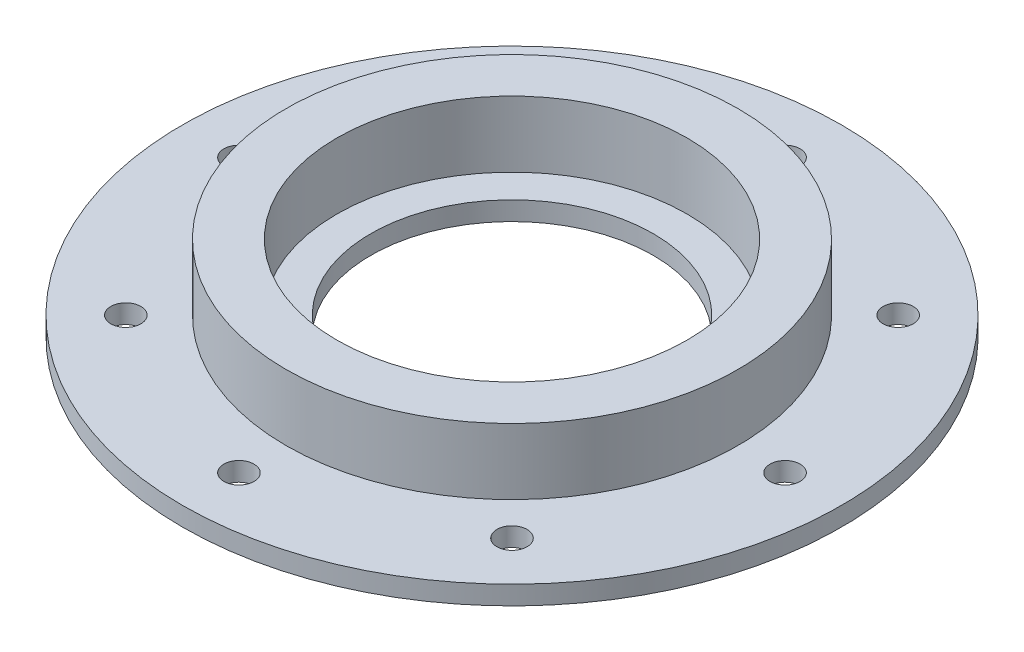
from build123d import *

# Parameters (mm, degrees)
SKETCH_1_R      = 35
SKETCH_1_R_2    = 15
SKETCH_1_R_3    = 1.6
EXTRUDE_1_DEPTH = 2
SKETCH_2_R      = 24
SKETCH_2_R_2    = 18.6
EXTRUDE_2_DEPTH = 7


with BuildPart() as part:
    # 草图1 → 凸台-拉伸1 (new body)
    with BuildSketch(Plane(origin=(0, 0, 0), x_dir=(1, 0, 0), z_dir=(0, 1, 0))):
        with Locations(Location((0, 0, 0), (0, 0, 270))):
            Circle(SKETCH_1_R)
        with Locations(Location((0, 0, 0), (0, 0, 270))):
            Circle(SKETCH_1_R_2, mode=Mode.SUBTRACT)
        with Locations(Location((29, 0, 0), (0, 0, 270))):
            Circle(SKETCH_1_R_3, mode=Mode.SUBTRACT)
        with Locations(Location((20.506096654, -20.506096654, 0), (0, 0, 270))):
            Circle(SKETCH_1_R_3, mode=Mode.SUBTRACT)
        with Locations(Location((0, -29, 0), (0, 0, 270))):
            Circle(SKETCH_1_R_3, mode=Mode.SUBTRACT)
        with Locations(Location((-20.506096654, -20.506096654, 0), (0, 0, 270))):
            Circle(SKETCH_1_R_3, mode=Mode.SUBTRACT)
        with Locations(Location((-29, 0, 0), (0, 0, 270))):
            Circle(SKETCH_1_R_3, mode=Mode.SUBTRACT)
        with Locations(Location((-20.506096654, 20.506096654, 0), (0, 0, 270))):
            Circle(SKETCH_1_R_3, mode=Mode.SUBTRACT)
        with Locations(Location((0, 29, 0), (0, 0, 270))):
            Circle(SKETCH_1_R_3, mode=Mode.SUBTRACT)
        with Locations(Location((20.506096654, 20.506096654, 0), (0, 0, 270))):
            Circle(SKETCH_1_R_3, mode=Mode.SUBTRACT)
    extrude(amount=-EXTRUDE_1_DEPTH)

    # 草图2 → 凸台-拉伸2 (add)
    with BuildSketch(Plane(origin=(0, 0, 0), x_dir=(1, 0, 0), z_dir=(0, 1, 0))):
        with Locations(Location((0, 0, 0), (0, 0, 270))):
            Circle(SKETCH_2_R)
        with Locations(Location((0, 0, 0), (0, 0, 270))):
            Circle(SKETCH_2_R_2, mode=Mode.SUBTRACT)
    extrude(amount=EXTRUDE_2_DEPTH)


solid = part.part
